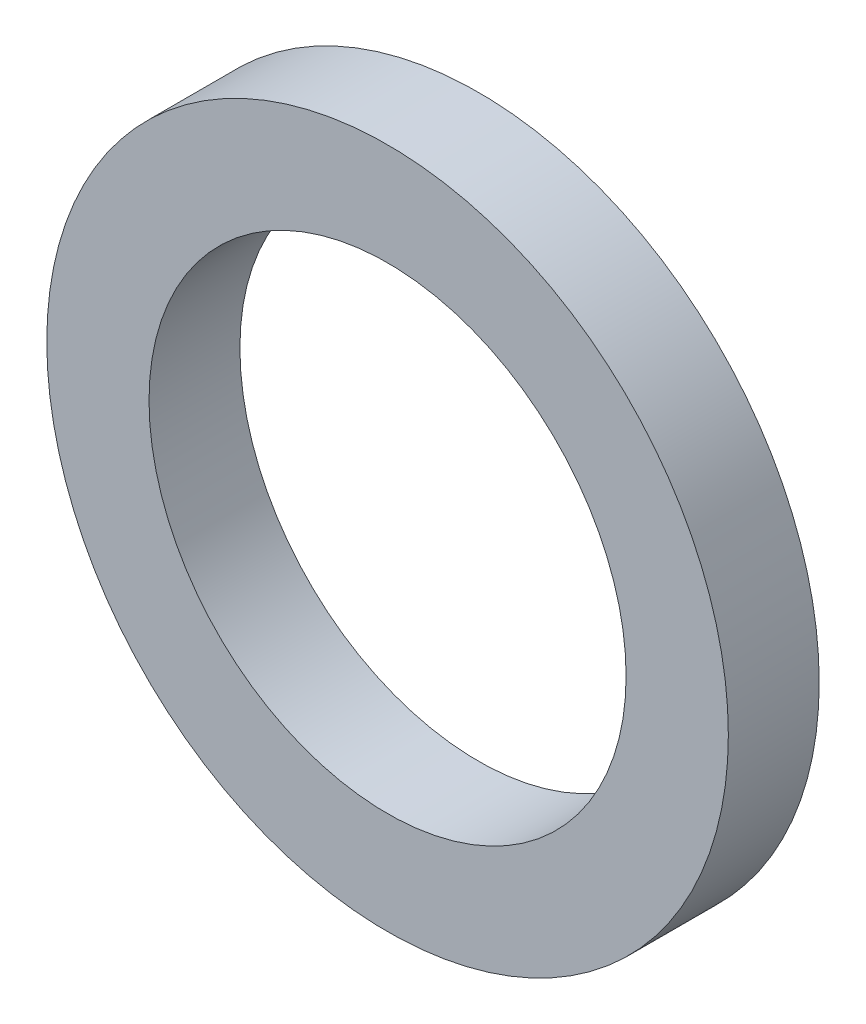
from build123d import *

# Parameters (mm, degrees)
SKETCH1_R      = 7.5
SKETCH1_R_2    = 5.25
EXTRUDE1_DEPTH = 2


with BuildPart() as part:
    # Sketch1 → Extrude1 (new body)
    with BuildSketch(Plane.XY):
        Circle(SKETCH1_R)
        Circle(SKETCH1_R_2, mode=Mode.SUBTRACT)
    extrude(amount=EXTRUDE1_DEPTH)


solid = part.part
